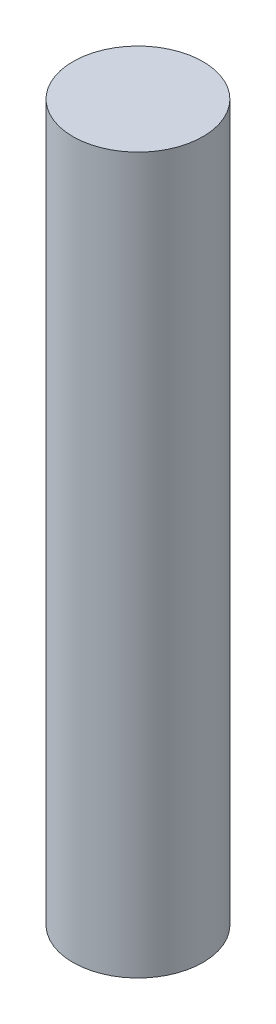
from build123d import *

# Parameters (mm, degrees)
BODY_R             = 2
BODY_EXTRUDE_DEPTH = 22


with BuildPart() as part:
    # BODY → Body Extrude (new body)
    with BuildSketch(Plane(origin=(0, 0, 0), x_dir=(1, 0, 0), z_dir=(0, 1, 0))):
        with Locations(Location((0, 0, 0), (0, 0, 270))):
            Circle(BODY_R)
    extrude(amount=BODY_EXTRUDE_DEPTH)


solid = part.part
